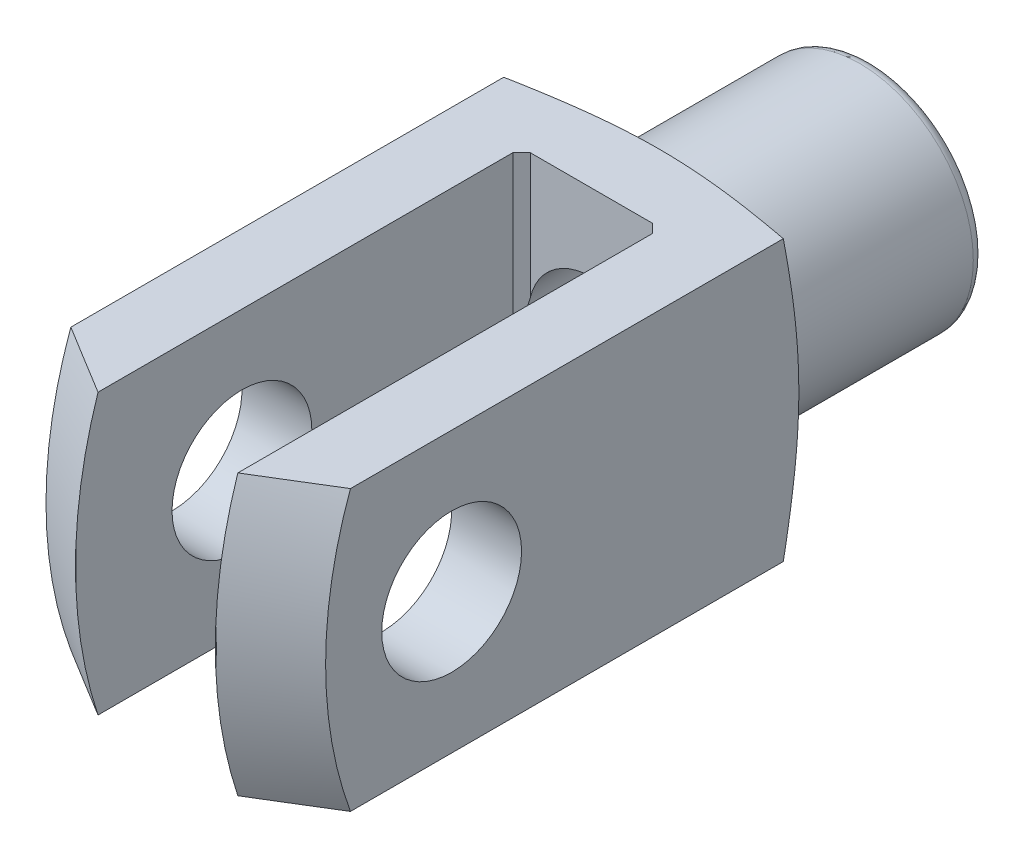
from build123d import *

# Parameters (mm, degrees)
CUT_EXTRUDE1_DEPTH           = 33
CUT_EXTRUDE1_DEPTH_BACK      = 33
CUT_EXTRUDE2_DEPTH           = 33
CUT_EXTRUDE2_DEPTH_BACK      = 33
CUT_EXTRUDE3_DEPTH           = 33
CUT_EXTRUDE3_DEPTH_BACK      = 33
SKETCH5_W                    = 39.5
SKETCH5_H                    = 8
CUT_REVOLVE3_ANGLE           = 90
CUT_REVOLVE3_OTHER_WAY_ANGLE = 90


with BuildPart() as part:
    # Sketch1 → Revolve1 (revolve)
    with BuildSketch(Plane(origin=(0, 0, 0), x_dir=(0, 0, -1), z_dir=(1, 0, 0))):
        with BuildLine():
            Line((-19, 0), (-19, 32))
            Line((-19, 32), (35.444863729, 32))
            Line((35.444863729, 32), (40, 15))
            ThreePointArc((40, 15), (40.585786438, 13.585786438), (42, 13))
            Line((42, 13), (62.7, 13))
            ThreePointArc((62.7, 13), (63.619238816, 12.619238816), (64, 11.7))
            Line((64, 11.7), (64, 0))
            Line((64, 0), (-19, 0))
        make_face()
    revolve(axis=Axis((0, 0, -64), (0, 0, 1)))

    # Sketch2 → Cut-Extrude1 (cut, two sides: drawn at the far end of the back side and taken through both)
    with BuildSketch(Plane(origin=(0, 0, 0), x_dir=(1, 0, 0), z_dir=(0, 1, 0)).offset(-CUT_EXTRUDE1_DEPTH_BACK)):
        Polygon((-8, 31), (-8, -20), (8, -20), (8, 31), (7, 32), (-7, 32), align=None)
    extrude(amount=CUT_EXTRUDE1_DEPTH + CUT_EXTRUDE1_DEPTH_BACK, mode=Mode.SUBTRACT)

    # Sketch3 → Cut-Extrude2 (cut, two sides: drawn at the far end of the back side and taken through both)
    with BuildSketch(Plane(origin=(0, 0, 0), x_dir=(0, 0, -1), z_dir=(1, 0, 0)).offset(-CUT_EXTRUDE2_DEPTH_BACK)):
        Polygon((-52, -48), (64, -48), (64, -16), (-20, -16), (-20, 16), (64, 16), (64, 48), (-52, 48), align=None)
    extrude(amount=CUT_EXTRUDE2_DEPTH + CUT_EXTRUDE2_DEPTH_BACK, mode=Mode.SUBTRACT)

    # Sketch4 → Cut-Extrude3 (cut, two sides: drawn at the far end of the back side and taken through both)
    with BuildSketch(Plane(origin=(0, 0, 0), x_dir=(1, 0, 0), z_dir=(0, 1, 0)).offset(-CUT_EXTRUDE3_DEPTH_BACK)):
        Polygon((-48, -52), (48, -52), (48, 64), (16, 64), (16, -20), (-16, -20), (-16, 64), (-48, 64), align=None)
    extrude(amount=CUT_EXTRUDE3_DEPTH + CUT_EXTRUDE3_DEPTH_BACK, mode=Mode.SUBTRACT)

    # Sketch5 → Cut-Revolve1 (revolve, cut)
    with BuildSketch(Plane.XY):
        with Locations((0, 4)):
            Rectangle(SKETCH5_W, SKETCH5_H)
    revolve(axis=Axis((19.75, 0, 0), (-1, 0, 0)), mode=Mode.SUBTRACT)

    # Sketch6 → Cut-Revolve2 (revolve, cut)
    with BuildSketch(Plane(origin=(0, 0, 0), x_dir=(0, 0, -1), z_dir=(1, 0, 0))):
        Polygon((30.9, 0), (30.9, 7.188), (63.288, 7.188), (64.1, 8), (64.1, 0), align=None)
    revolve(axis=Axis((0, 0, -64.1), (0, 0, 1)), mode=Mode.SUBTRACT)

    # Sketch7 → Cut-Revolve3 (revolve, cut)
    with BuildSketch(Plane(origin=(0, 0, 0), x_dir=(1, 0, 0), z_dir=(0, 1, 0))):
        Polygon((-19, -49.64182924), (0, -60.611484355), (19, -49.64182924), (19, -12.691412012), (0, -23.661067127), (-19, -12.691412012), align=None)
    revolve(axis=Axis((-19, 0, -32), (-1, 0, 0)), revolution_arc=CUT_REVOLVE3_ANGLE, mode=Mode.SUBTRACT)

    # Sketch7 → Cut-Revolve3 other way (revolve, cut)
    with BuildSketch(Plane(origin=(0, 0, 0), x_dir=(1, 0, 0), z_dir=(0, 1, 0))):
        Polygon((-19, -49.64182924), (0, -60.611484355), (19, -49.64182924), (19, -12.691412012), (0, -23.661067127), (-19, -12.691412012), align=None)
    revolve(axis=Axis((-19, 0, -32), (1, 0, 0)), revolution_arc=CUT_REVOLVE3_OTHER_WAY_ANGLE, mode=Mode.SUBTRACT)


solid = part.part
